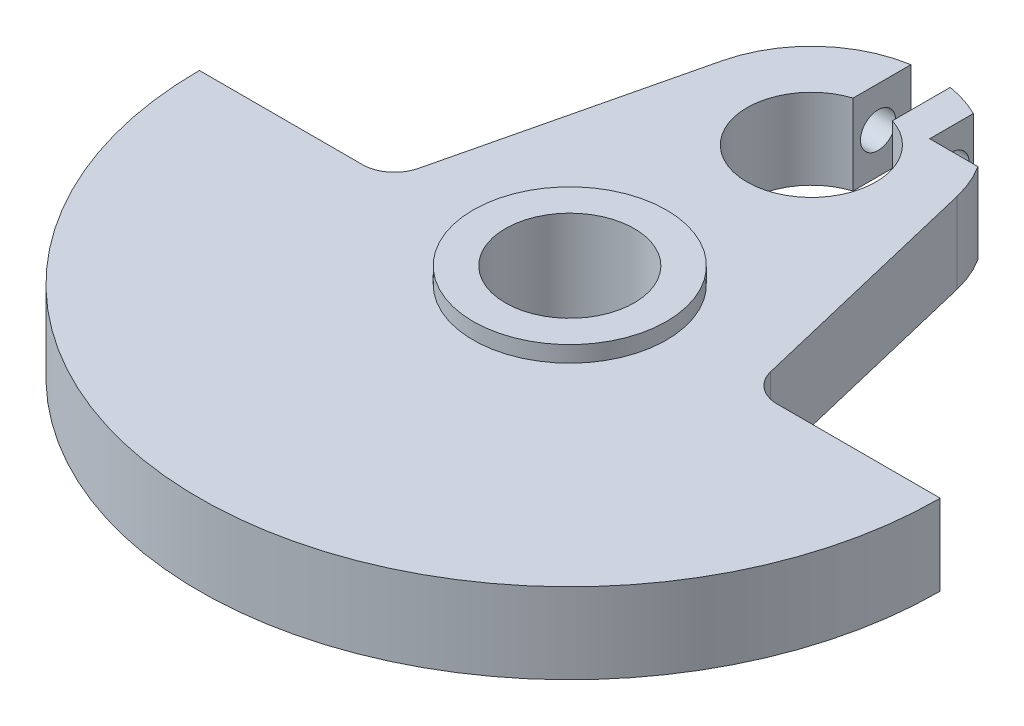
from build123d import *

# Parameters (mm, degrees)
BOSS_EXTRUDE1_DEPTH     = 5
SKETCH2_R               = 6
BOSS_EXTRUDE2_DEPTH     = 1
SKETCH3_R               = 4
CUT_EXTRUDE1_DEPTH      = 34.075670817
CUT_EXTRUDE2_START      = -10
CUT_EXTRUDE2_DEPTH      = 10
CUT_EXTRUDE3_START      = -10
CUT_EXTRUDE3_DEPTH      = 10
CUT_EXTRUDE4_DEPTH      = 34.075670817
CUT_EXTRUDE4_DEPTH_BACK = 34.075670817
SKETCH7_R               = 1.0922


with BuildPart() as part:
    # Sketch1 → Boss-Extrude1 (new body)
    with BuildSketch(Plane(origin=(0, 0, 0), x_dir=(1, 0, 0), z_dir=(0, 1, 0))):
        with BuildLine():
            Line((-23, 0), (-12.87798214, 0))
            ThreePointArc((-12.87798214, 0), (-11.639160434, 0.429865999), (-10.932866059, 1.534679219))
            Line((-10.932866059, 1.534679219), (-7.294185306, 16.74495293))
            ThreePointArc((-7.294185306, 16.74495293), (0, 22.5), (7.294185306, 16.74495293))
            Line((7.294185306, 16.74495293), (10.932866059, 1.534679219))
            ThreePointArc((10.932866059, 1.534679219), (11.639160434, 0.429865999), (12.87798214, 0))
            Line((12.87798214, 0), (23, 0))
            ThreePointArc((23, 0), (0, -23), (-23, 0))
        make_face()
    extrude(amount=BOSS_EXTRUDE1_DEPTH)

    # Sketch2 → Boss-Extrude2 (add)
    with BuildSketch(Plane(origin=(0, 5, 0), x_dir=(1, 0, 0), z_dir=(0, 1, 0))):
        with Locations(Location((0, 0, 0), (0, 0, 90))):
            Circle(SKETCH2_R)
    extrude(amount=BOSS_EXTRUDE2_DEPTH)

    # Sketch3 → Cut-Extrude1 (cut, through all)
    with BuildSketch(Plane(origin=(0, 6, 0), x_dir=(1, 0, 0), z_dir=(0, 1, 0))):
        with Locations(Location((0, 0, 0), (0, 0, 270))):
            Circle(SKETCH3_R)
    extrude(amount=-CUT_EXTRUDE1_DEPTH, mode=Mode.SUBTRACT)

    # Sketch4 → Cut-Extrude2 (cut)
    with BuildSketch(Plane(origin=(0, 5, 0), x_dir=(1, 0, 0), z_dir=(0, 1, 0)).offset(CUT_EXTRUDE2_START)):
        with BuildLine():
            Line((-1.220655562, 18.809199391), (-1.220655562, 22.4))
            ThreePointArc((-1.220655562, 22.4), (0, 22.5), (1.220655562, 22.4))
            Line((1.220655562, 22.4), (1.220655562, 18.809199391))
            ThreePointArc((1.220655562, 18.809199391), (0, 11), (-1.220655562, 18.809199391))
        make_face()
    extrude(amount=CUT_EXTRUDE2_DEPTH, mode=Mode.SUBTRACT)

    # Sketch5 → Cut-Extrude3 (cut)
    with BuildSketch(Plane(origin=(0, 5, 0), x_dir=(1, 0, 0), z_dir=(0, 1, 0)).offset(CUT_EXTRUDE3_START)):
        with BuildLine():
            Line((3.34428877, 19), (6.34428877, 19))
            ThreePointArc((6.34428877, 19), (5.030642475, 20.562610564), (3.34428877, 21.713101565))
            Line((3.34428877, 21.713101565), (3.34428877, 19))
        make_face()
    extrude(amount=CUT_EXTRUDE3_DEPTH, mode=Mode.SUBTRACT)

    # Sketch7 → Cut-Extrude4 (cut, two sides: drawn at the far end of the back side and taken through both)
    with BuildSketch(Plane(origin=(0, 0, 0), x_dir=(0, 0, -1), z_dir=(1, 0, 0)).offset(-CUT_EXTRUDE4_DEPTH_BACK)):
        with Locations((20.358101565, 2.5)):
            Circle(SKETCH7_R)
    extrude(amount=CUT_EXTRUDE4_DEPTH + CUT_EXTRUDE4_DEPTH_BACK, mode=Mode.SUBTRACT)


solid = part.part
